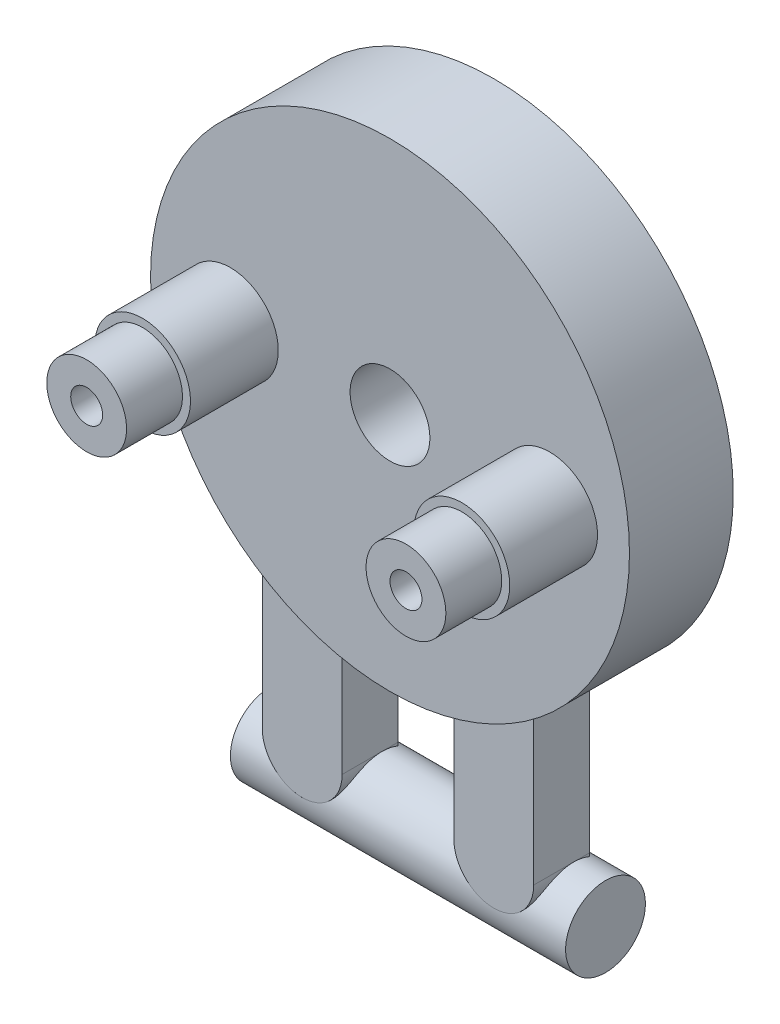
from build123d import *

# Parameters (mm, degrees)
SKETCH1_R                   = 15
BOSS_EXTRUDE1_DEPTH         = 3.25
BOSS_EXTRUDE2_START         = -0.5
BOSS_EXTRUDE2_DEPTH         = 3.5
FILLET1_RADIUS              = 2.5
FILLET1_LENGTH              = 3.5
FILLET1_OF_MIRROR1_2_RADIUS = 2.5
FILLET1_OF_MIRROR1_2_LENGTH = 3.5
SKETCH3_R                   = 2.5
BOSS_EXTRUDE3_DEPTH         = 10.5
SKETCH4_R                   = 3
BOSS_EXTRUDE4_DEPTH         = 5.5
SKETCH5_R                   = 2.5
BOSS_EXTRUDE5_DEPTH         = 3.5
SKETCH6_R                   = 1
CUT_EXTRUDE1_DEPTH          = 9
SKETCH7_R                   = 2.5
CUT_EXTRUDE2_DEPTH          = 32.752952702


with BuildPart() as part:
    # Sketch1 → Boss-Extrude1 (new, symmetric)
    with BuildSketch(Plane.XY):
        with Locations(Location((0, 0, 0), (0, 0, 180))):
            Circle(SKETCH1_R)
    extrude(amount=BOSS_EXTRUDE1_DEPTH, both=True)

    # Sketch2 → Boss-Extrude2 (add)
    with BuildSketch(Plane.XY.offset(3.25).offset(BOSS_EXTRUDE2_START)):
        with BuildLine():
            Line((-8.5, -12.359207094), (-8.5, -24))
            Line((-8.5, -24), (-3.5, -24))
            Line((-3.5, -24), (-3.5, -14.585952146))
            ThreePointArc((-3.5, -14.585952146), (-6.102425615, -13.702569161), (-8.5, -12.359207094))
        make_face()
    boss_extrude2 = extrude(amount=-BOSS_EXTRUDE2_DEPTH)

    # Fillet1: full round fillet: the end face becomes a half cylinder, R = half its width
    fillet1_face = Plane((-6, -24, 1), x_dir=(0, 0, 1), z_dir=(0, -1, 0))  # on the end face: x along it, z out of the body
    fillet1_slab = fillet1_face.offset(-FILLET1_RADIUS / 2) * Box(FILLET1_LENGTH, 2 * FILLET1_RADIUS, FILLET1_RADIUS, mode=Mode.PRIVATE)  # the body's end, R deep
    fillet1_round = Plane((-6, -21.5, 1), x_dir=(0, -1, 0), z_dir=(0, 0, 1)) * Cylinder(FILLET1_RADIUS, FILLET1_LENGTH, mode=Mode.PRIVATE)  # its axis R under the face
    add(fillet1_slab - fillet1_round, mode=Mode.SUBTRACT)

    # Mirror1: Boss-Extrude2 across plane
    add(boss_extrude2.mirror(Plane(origin=(0, 0, 0), x_dir=(0, 0, 1), z_dir=(1, 0, 0))))

    # Fillet1 of Mirror1 2: full round fillet: the end face becomes a half cylinder, R = half its width
    fillet1_of_mirror1_2_face = Plane((6, -24, 1), x_dir=(0, 0, 1), z_dir=(0, -1, 0))  # on the end face: x along it, z out of the body
    fillet1_of_mirror1_2_slab = fillet1_of_mirror1_2_face.offset(-FILLET1_OF_MIRROR1_2_RADIUS / 2) * Box(FILLET1_OF_MIRROR1_2_LENGTH, 2 * FILLET1_OF_MIRROR1_2_RADIUS, FILLET1_OF_MIRROR1_2_RADIUS, mode=Mode.PRIVATE)  # the body's end, R deep
    fillet1_of_mirror1_2_round = Plane((6, -21.5, 1), x_dir=(0, -1, 0), z_dir=(0, 0, 1)) * Cylinder(FILLET1_OF_MIRROR1_2_RADIUS, FILLET1_OF_MIRROR1_2_LENGTH, mode=Mode.PRIVATE)  # its axis R under the face
    add(fillet1_of_mirror1_2_slab - fillet1_of_mirror1_2_round, mode=Mode.SUBTRACT)

    # Sketch3 → Boss-Extrude3 (add, symmetric)
    with BuildSketch(Plane(origin=(0, 0, 0), x_dir=(0, 0, -1), z_dir=(1, 0, 0))):
        with Locations((-0.25, -24)):
            Circle(SKETCH3_R)
    extrude(amount=BOSS_EXTRUDE3_DEPTH, both=True)

    # Sketch4 → Boss-Extrude4 (add)
    with BuildSketch(Plane.XY.offset(3.25)):
        with Locations((10, 0)):
            Circle(SKETCH4_R)
    boss_extrude4 = extrude(amount=BOSS_EXTRUDE4_DEPTH)

    # Sketch5 → Boss-Extrude5 (add)
    with BuildSketch(Plane.XY.offset(8.75)):
        with Locations((10, 0)):
            Circle(SKETCH5_R)
    boss_extrude5 = extrude(amount=BOSS_EXTRUDE5_DEPTH)

    # Sketch6 → Cut-Extrude1 (cut)
    with BuildSketch(Plane.XY.offset(12.25)):
        with Locations((10, 0)):
            Circle(SKETCH6_R)
    cut_extrude1 = extrude(amount=-CUT_EXTRUDE1_DEPTH, mode=Mode.SUBTRACT)

    # Mirror2: Boss-Extrude4, Boss-Extrude5, Cut-Extrude1 across plane
    add(boss_extrude4.mirror(Plane(origin=(0, 0, 0), x_dir=(0, 0, 1), z_dir=(1, 0, 0))))
    add(boss_extrude5.mirror(Plane(origin=(0, 0, 0), x_dir=(0, 0, 1), z_dir=(1, 0, 0))))
    add(cut_extrude1.mirror(Plane(origin=(0, 0, 0), x_dir=(0, 0, 1), z_dir=(1, 0, 0))), mode=Mode.SUBTRACT)

    # Sketch7 → Cut-Extrude2 (cut, through all)
    with BuildSketch(Plane.XY.offset(3.25)):
        Circle(SKETCH7_R)
    extrude(amount=-CUT_EXTRUDE2_DEPTH, mode=Mode.SUBTRACT)


solid = part.part
